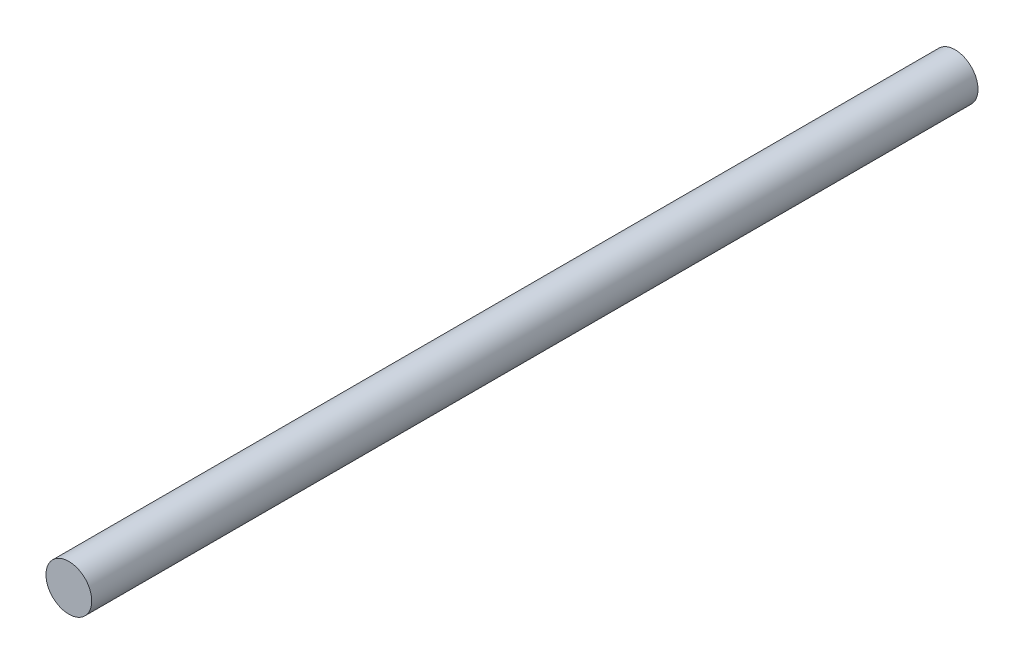
from build123d import *

# Parameters (mm, degrees)
CROQUIS1_R              = 31
SALIENTE_EXTRUIR1_DEPTH = 1200


with BuildPart() as part:
    # Croquis1 → Saliente-Extruir1 (new body)
    with BuildSketch(Plane.XY):
        with Locations((-44.558907259, 16.213949447)):
            Circle(CROQUIS1_R)
    extrude(amount=SALIENTE_EXTRUIR1_DEPTH)


solid = part.part
